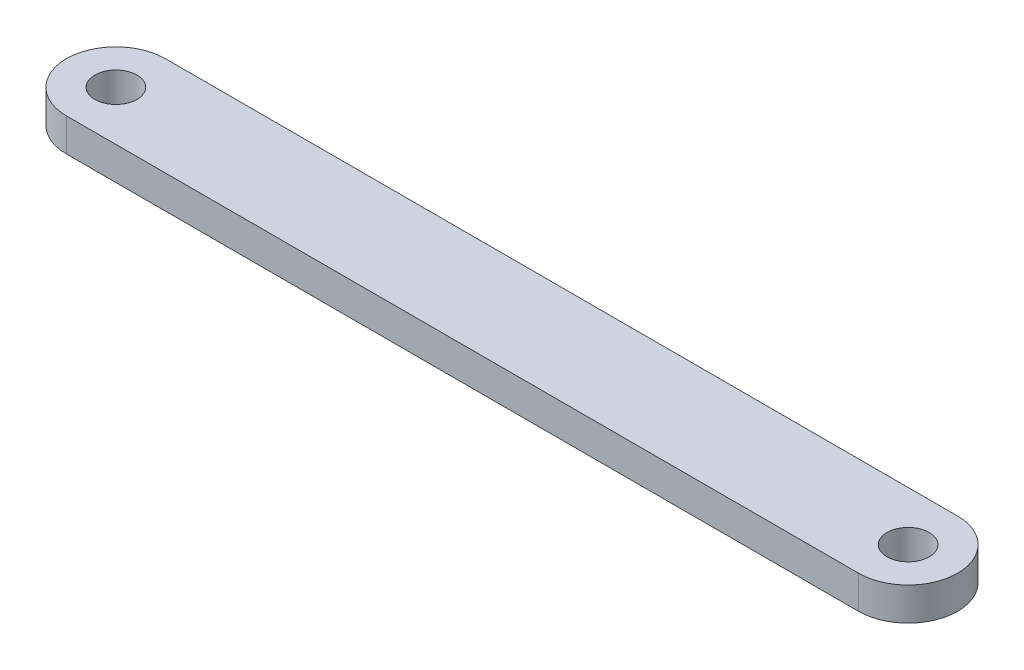
from build123d import *

# Parameters (mm, degrees)
SKETCH1_R      = 2.032
EXTRUDE1_DEPTH = 3.175


with BuildPart() as part:
    # Sketch1 → Extrude1 (new body)
    with BuildSketch(Plane(origin=(0, 0, 0), x_dir=(1, 0, 0), z_dir=(0, 1, 0))):
        with BuildLine():
            Line((-49.618495469, -5.601179245), (26.581504531, -5.601179245))
            ThreePointArc((26.581504531, -5.601179245), (31.344004531, -0.838679245), (26.581504531, 3.923820755))
            Line((26.581504531, 3.923820755), (-49.618495469, 3.923820755))
            ThreePointArc((-49.618495469, 3.923820755), (-54.380995469, -0.838679245), (-49.618495469, -5.601179245))
        make_face()
        with Locations(Location((-49.618495469, -0.838679245, 0), (0, 0, 270))):
            Circle(SKETCH1_R, mode=Mode.SUBTRACT)
        with Locations(Location((26.581504531, -0.838679245, 0), (0, 0, 270))):
            Circle(SKETCH1_R, mode=Mode.SUBTRACT)
    extrude(amount=EXTRUDE1_DEPTH)


solid = part.part
